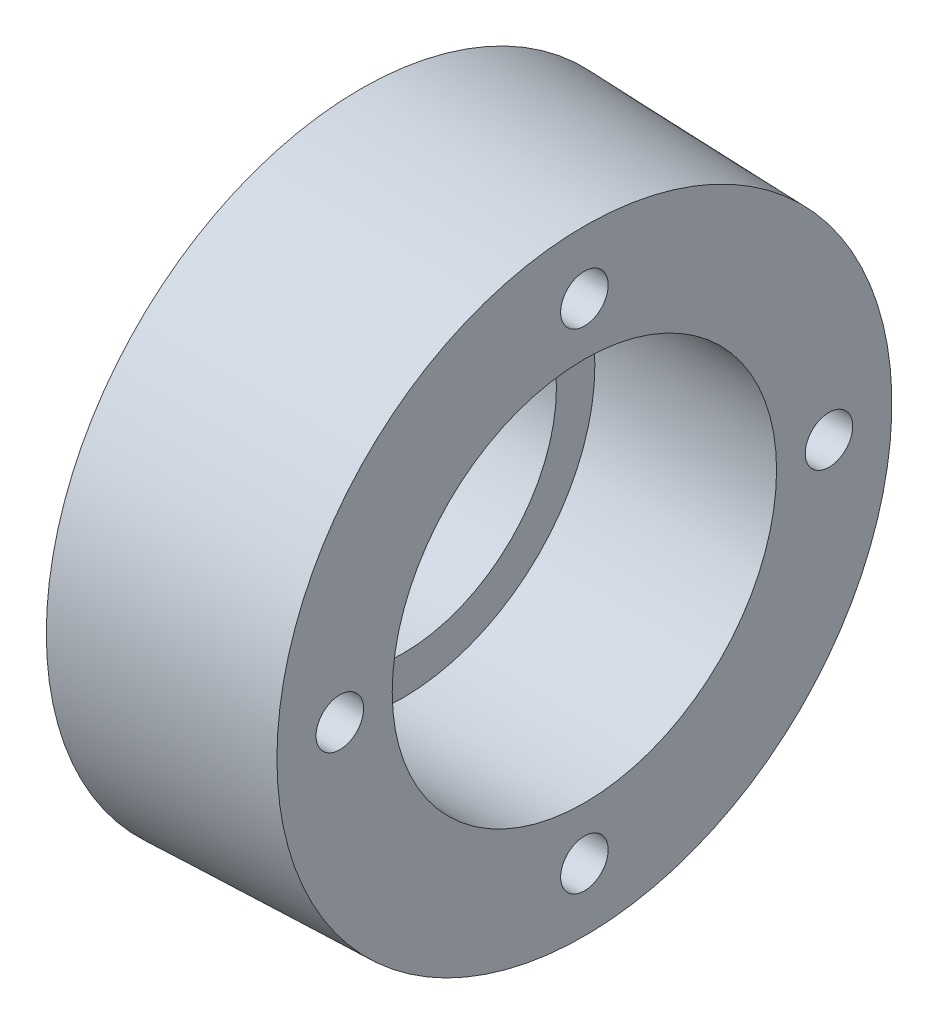
from build123d import *

# Parameters (mm, degrees)
DAIRESEL_KAPLAMA1_COUNT = 4


with BuildPart() as part:
    # Çizim2 → Döndür1 (revolve)
    with BuildSketch(Plane.XY, mode=Mode.PRIVATE) as d_nd_r1_sk:
        Polygon((0, 22), (11, 22), (11, 27.5), (37, 27.5), (37, 44), (5, 45), (5, 28), (0, 28), align=None)
    revolve(d_nd_r1_sk.sketch.rotate(Axis((0, 0, 0), (1, 0, 0)), 90), axis=Axis((0, 0, 0), (1, 0, 0)))

    # Çizim5 → M8 Dişli Delik1 (revolve, cut)
    with BuildSketch(Plane(origin=(37, 35, 0), x_dir=(0, 0, -1), z_dir=(0, 1, 0))):
        Polygon((0, 0), (0, 24.292926105), (3.4, 22.25), (3.4, 0), align=None)
    m8_di_li_delik1 = revolve(axis=Axis((43.35, 35, 0), (-1, 0, 0)), mode=Mode.SUBTRACT)

    # Dairesel Kaplama1: M8 Dişli Delik1 ×4 about axis
    dairesel_kaplama1_axis = Axis((0, 0, 0), (1, 0, 0))
    for i in range(1, DAIRESEL_KAPLAMA1_COUNT):
        add(m8_di_li_delik1.rotate(dairesel_kaplama1_axis, i * 360 / DAIRESEL_KAPLAMA1_COUNT), mode=Mode.SUBTRACT)


solid = part.part
